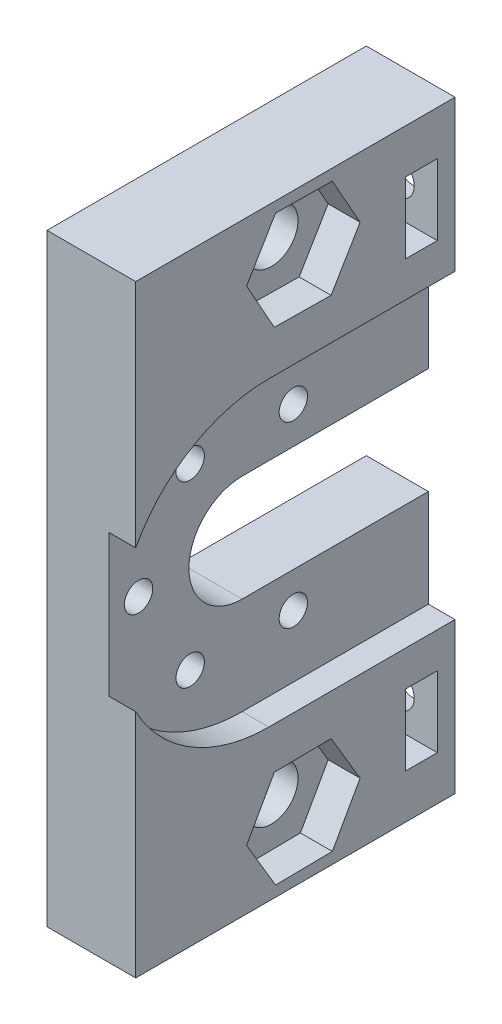
from build123d import *

# Parameters (mm, degrees)
SKETCH_1_R          = 0.8
EXTRUDE_5_DEPTH     = 5
SKETCH_6_R          = 0.8
CUT_EXTRUDE_1_DEPTH = 1.5
SKETCH_7_R          = 1.5
CUT_EXTRUDE_2_DEPTH = 21.597329924
CUT_EXTRUDE_4_DEPTH = 1.8
SKETCH_9_R          = 1
CUT_EXTRUDE_5_DEPTH = 1
SKETCH_10_W         = 4
SKETCH_10_H         = 1.8
CUT_EXTRUDE_6_DEPTH = 4.6


with BuildPart() as part:
    # ｽｹｯﾁ1 → ﾎﾞｽ - 押し出し5 (new body)
    # profile 1 of 3: a face of its own
    with BuildSketch(Plane.YZ):
        with BuildLine():
            Line((-3, -10.5), (-3, -7.95298686))
            ThreePointArc((-3, -7.95298686), (-8.482257997, -0.548907345), (-4, 7.5))
            Line((-4, 7.5), (-17, 7.5))
            Line((-17, 7.5), (-17, -10.5))
            Line((-17, -10.5), (-3, -10.5))
        make_face()
    # profile 2 of 3: a face of its own
    with BuildSketch(Plane.YZ):
        with BuildLine():
            ThreePointArc((-3, 0), (0, 3), (3, 0))
            Line((3, 0), (3, -7.95298686))
            ThreePointArc((3, -7.95298686), (6.991065727, -4.834769901), (8.5, 0))
            ThreePointArc((8.5, 0), (7.288689869, 4.373213921), (4, 7.5))
            Line((4, 7.5), (-4, 7.5))
            ThreePointArc((-4, 7.5), (-8.482257997, -0.548907345), (-3, -7.95298686))
            Line((-3, -7.95298686), (-3, 0))
        make_face()
        with Locations(Location((-5, -2.886751346, 0), (0, 0, 270))):
            Circle(SKETCH_1_R, mode=Mode.SUBTRACT)
        with Locations(Location((5.074182173, -2.886751346, 0), (0, 0, 270))):
            Circle(SKETCH_1_R, mode=Mode.SUBTRACT)
        with Locations(Location((-5, 2.929580443, 0), (0, 0, 270))):
            Circle(SKETCH_1_R, mode=Mode.SUBTRACT)
        with Locations(Location((5.074182173, 2.929580443, 0), (0, 0, 270))):
            Circle(SKETCH_1_R, mode=Mode.SUBTRACT)
        with Locations(Location((0.037091086, 5.837746338, 0), (0, 0, 270))):
            Circle(SKETCH_1_R, mode=Mode.SUBTRACT)
    # profile 3 of 3: a face of its own
    with BuildSketch(Plane.YZ):
        with BuildLine():
            ThreePointArc((8.5, 0), (6.991065727, -4.834769901), (3, -7.95298686))
            Line((3, -7.95298686), (3, -10.5))
            Line((3, -10.5), (17, -10.5))
            Line((17, -10.5), (17, 7.5))
            Line((17, 7.5), (4, 7.5))
            ThreePointArc((4, 7.5), (7.288689869, 4.373213921), (8.5, 0))
        make_face()
    extrude(amount=-EXTRUDE_5_DEPTH)

    # ｽｹｯﾁ6 → ｶｯﾄ - 押し出し1 (cut)
    # profile 1 of 5: a face of its own
    with BuildSketch(Plane.YZ):
        with BuildLine():
            ThreePointArc((-4, 7.5), (-7.288689869, 4.373213921), (-8.5, 0))
            Line((-8.5, 0), (-3, 0))
            ThreePointArc((-3, 0), (0, 3), (3, 0))
            Line((3, 0), (8.5, 0))
            ThreePointArc((8.5, 0), (7.288689869, 4.373213921), (4, 7.5))
            Line((4, 7.5), (-4, 7.5))
        make_face()
        with Locations(Location((-5, 2.929580443, 0), (0, 0, 270))):
            Circle(SKETCH_6_R, mode=Mode.SUBTRACT)
        with Locations(Location((5.074182173, 2.929580443, 0), (0, 0, 270))):
            Circle(SKETCH_6_R, mode=Mode.SUBTRACT)
        with Locations(Location((0.037091086, 5.837746338, 0), (0, 0, 270))):
            Circle(SKETCH_6_R, mode=Mode.SUBTRACT)
    # profile 2 of 5: a face of its own
    with BuildSketch(Plane.YZ):
        with BuildLine():
            Line((-3, 0), (-8.5, 0))
            ThreePointArc((-8.5, 0), (-6.991065727, -4.834769901), (-3, -7.95298686))
            Line((-3, -7.95298686), (-3, 0))
        make_face()
        with Locations(Location((-5, -2.886751346, 0), (0, 0, 270))):
            Circle(SKETCH_6_R, mode=Mode.SUBTRACT)
    # profile 3 of 5: a face of its own
    with BuildSketch(Plane.YZ):
        with BuildLine():
            Line((8.5, 0), (3, 0))
            Line((3, 0), (3, -7.95298686))
            ThreePointArc((3, -7.95298686), (6.991065727, -4.834769901), (8.5, 0))
        make_face()
        with Locations(Location((5.074182173, -2.886751346, 0), (0, 0, 270))):
            Circle(SKETCH_6_R, mode=Mode.SUBTRACT)
    # profile 4 of 5: a face of its own
    with BuildSketch(Plane.YZ):
        with BuildLine():
            ThreePointArc((8.5, 0), (6.991065727, -4.834769901), (3, -7.95298686))
            Line((3, -7.95298686), (3, -10.5))
            Line((3, -10.5), (8.5, -10.5))
            Line((8.5, -10.5), (8.5, 0))
        make_face()
    # profile 5 of 5: a face of its own
    with BuildSketch(Plane.YZ):
        with BuildLine():
            ThreePointArc((-3, -7.95298686), (-6.991065727, -4.834769901), (-8.5, 0))
            Line((-8.5, 0), (-8.5, -10.5))
            Line((-8.5, -10.5), (-3, -10.5))
            Line((-3, -10.5), (-3, -7.95298686))
        make_face()
    extrude(amount=-CUT_EXTRUDE_1_DEPTH, mode=Mode.SUBTRACT)

    # ｽｹｯﾁ7 → ｶｯﾄ - 押し出し2 (cut, through all)
    with BuildSketch(Plane(origin=(-5, 0, 0), x_dir=(0, -1, 0), z_dir=(-1, 0, 0))):
        with Locations(Location((-13.611024943, -1.95, 0), (0, 0, 90))):
            Circle(SKETCH_7_R)
        with Locations(Location((13.611024943, -1.95, 0), (0, 0, 270))):
            Circle(SKETCH_7_R)
    extrude(amount=-CUT_EXTRUDE_2_DEPTH, mode=Mode.SUBTRACT)

    # ｽｹｯﾁ8 → ｶｯﾄ - 押し出し4 (cut)
    with BuildSketch(Plane.YZ):
        Polygon((10.81922748, -3.513926764), (10.860725904, -0.314195857), (13.652523367, 1.249730908), (16.402822406, -0.386073236), (16.361323982, -3.585804143), (13.569526519, -5.149730908), align=None)
        Polygon((-10.860725904, -0.314195857), (-13.652523367, 1.249730908), (-16.402822406, -0.386073236), (-16.361323982, -3.585804143), (-13.569526519, -5.149730908), (-10.81922748, -3.513926764), align=None)
    extrude(amount=-CUT_EXTRUDE_4_DEPTH, mode=Mode.SUBTRACT)

    # ｽｹｯﾁ9 → ｶｯﾄ - 押し出し5 (cut)
    with BuildSketch(Plane(origin=(0, 0, -10.5), x_dir=(1, 0, 0), z_dir=(0, 0, -1))):
        with Locations(Location((-2.3, 12.508141571, 0), (0, 0, 180))):
            Circle(SKETCH_9_R)
        with Locations((-2.3, -12.508141571)):
            Circle(SKETCH_9_R)
    extrude(amount=-CUT_EXTRUDE_5_DEPTH, mode=Mode.SUBTRACT)

    # ｽｹｯﾁ10 → ｶｯﾄ - 押し出し6 (cut)
    with BuildSketch(Plane.YZ):
        with Locations((-12.5, -8.6)):
            Rectangle(SKETCH_10_W, SKETCH_10_H)
        with Locations((12.5, -8.6)):
            Rectangle(SKETCH_10_W, SKETCH_10_H)
    extrude(amount=-CUT_EXTRUDE_6_DEPTH, mode=Mode.SUBTRACT)


solid = part.part
